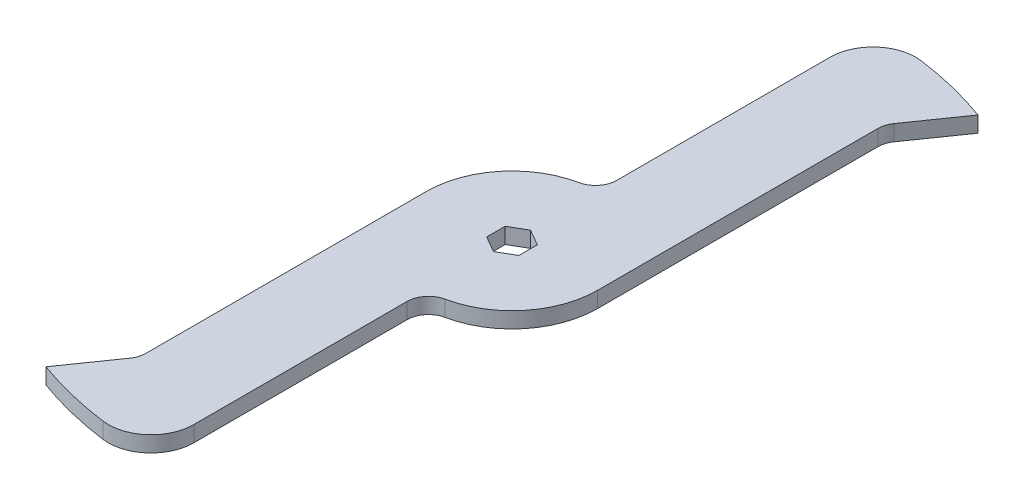
from build123d import *

# Parameters (mm, degrees)
BOSS_EXTRUDE1_DEPTH = 4.699
CUT_EXTRUDE1_REACH  = 116.14
FILLET1_R           = 6.35
FILLET2_R           = 12.7


with BuildPart() as part:
    # Sketch1 → Boss-Extrude1 (new body)
    with BuildSketch(Plane(origin=(0, 0, 0), x_dir=(1, 0, 0), z_dir=(0, 1, 0))):
        with BuildLine():
            Line((0, 25.4), (0, 107.95))
            ThreePointArc((0, 107.95), (18.67009518, 106.323233801), (36.777487633, 101.491964724))
            Line((36.777487633, 101.491964724), (25.4, 85.194189943))
            Line((25.4, 85.194189943), (25.4, 0))
            ThreePointArc((25.4, 0), (17.960512242, -17.960512242), (0, -25.4))
            Line((0, -25.4), (0, -107.95))
            ThreePointArc((0, -107.95), (-18.67009518, -106.323233801), (-36.777487633, -101.491964724))
            Line((-36.777487633, -101.491964724), (-25.4, -85.194189943))
            Line((-25.4, -85.194189943), (-25.4, 0))
            ThreePointArc((-25.4, 0), (-17.960512242, 17.960512242), (0, 25.4))
        make_face()
    extrude(amount=BOSS_EXTRUDE1_DEPTH)

    # Sketch2 → Cut-Extrude1 (cut, up to next)
    with BuildSketch(Plane(origin=(0, 4.699, 0), x_dir=(1, 0, 0), z_dir=(0, 1, 0)), mode=Mode.PRIVATE) as cut_extrude1_sk1:
        Polygon((0, 5.499261314), (-4.7625, 2.749630657), (-4.7625, -2.749630657), (0, -5.499261314), (4.7625, -2.749630657), (4.7625, 2.749630657), align=None)
    cut_extrude1_tool1 = extrude(cut_extrude1_sk1.sketch, amount=-CUT_EXTRUDE1_REACH, mode=Mode.PRIVATE) & part.part
    add(cut_extrude1_tool1.solids().sort_by_distance((0, 4.699, 0))[0], mode=Mode.SUBTRACT)

    # Fillet1
    fillet1_edges = [part.edges().sort_by_distance(p)[0] for p in [
        (0, 2.3495, -25.4),
        (25.4, 2.3495, -85.194189943),
        (0, 2.3495, 25.4),
        (-25.4, 2.3495, 85.194189943),
    ]]
    fillet(fillet1_edges, radius=FILLET1_R)

    # Fillet2
    fillet2_edges = [part.edges().sort_by_distance(p)[0] for p in [
        (0, 2.3495, -107.95),
        (0, 2.3495, 107.95),
    ]]
    fillet(fillet2_edges, radius=FILLET2_R)


solid = part.part
